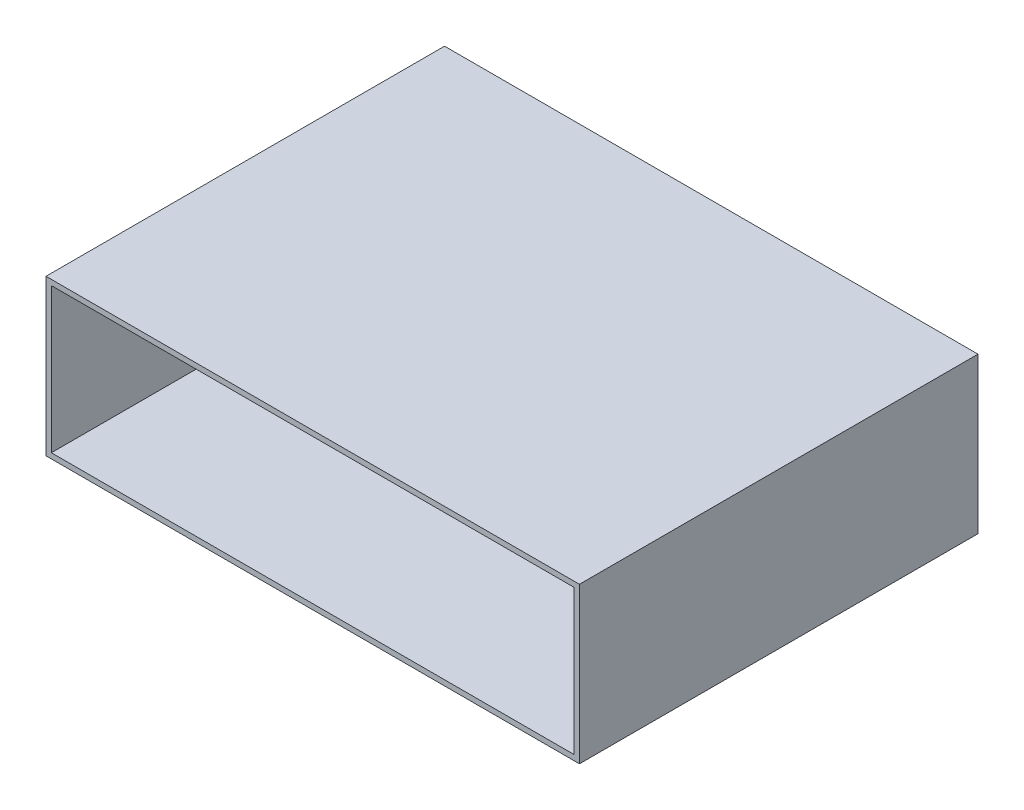
from build123d import *

# Parameters (mm, degrees)
SKETCH1_W           = 315.575
SKETCH1_H           = 92
SKETCH1_W_2         = 309.225
SKETCH1_H_2         = 85.65
BOSS_EXTRUDE1_DEPTH = 235.775
SKETCH1_2_W         = 309.225
SKETCH1_2_H         = 85.65
BOSS_EXTRUDE2_DEPTH = 3.175


with BuildPart() as part:
    # Sketch1 → Boss-Extrude1 (new body)
    with BuildSketch(Plane.XY):
        Rectangle(SKETCH1_W, SKETCH1_H)
        Rectangle(SKETCH1_W_2, SKETCH1_H_2, mode=Mode.SUBTRACT)
    extrude(amount=BOSS_EXTRUDE1_DEPTH)

    # Sketch1<2> → Boss-Extrude2 (add)
    with BuildSketch(Plane.XY):
        Rectangle(SKETCH1_2_W, SKETCH1_2_H)
    extrude(amount=BOSS_EXTRUDE2_DEPTH)


solid = part.part
